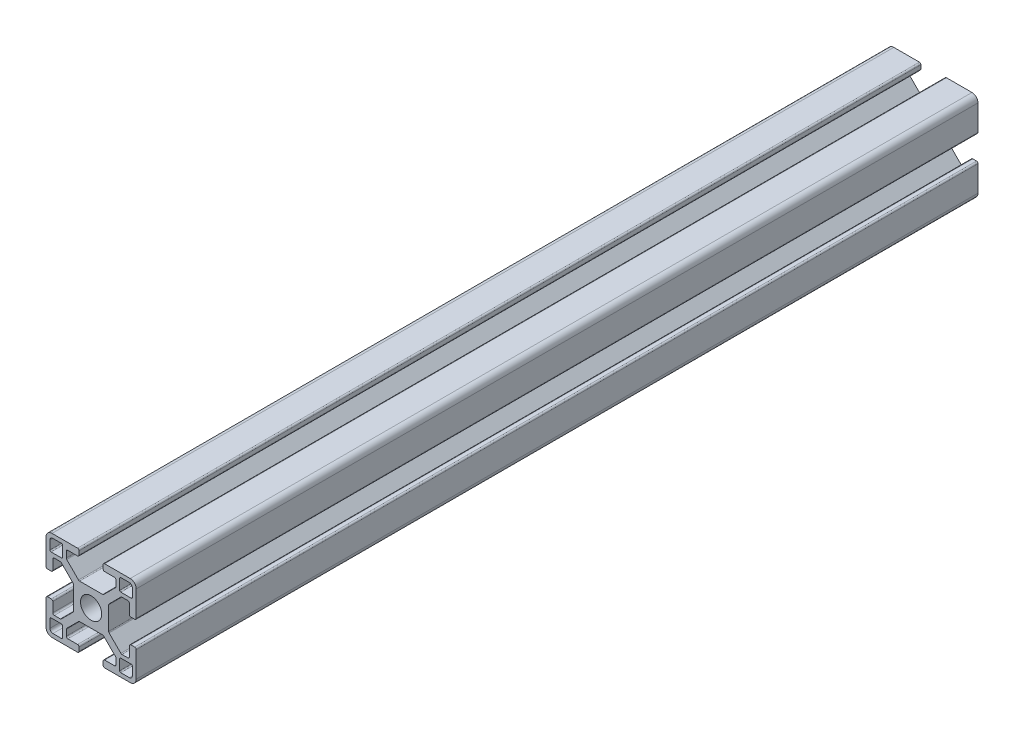
from build123d import *

# Parameters (mm, degrees)
SKETCH1_R           = 3.52998588
BOSS_EXTRUDE1_DEPTH = 140
SKETCH2_R           = 2.5
CUT_EXTRUDE1_DEPTH  = 27


with BuildPart() as part:
    # Sketch1 → Boss-Extrude1 (new, symmetric)
    with BuildSketch(Plane.XY):
        with BuildLine():
            Line((14.49994, -4), (13.24247465, -4))
            ThreePointArc((13.24247465, -4), (12.88892126, -4.146446609), (12.74247465, -4.5))
            Line((12.74247465, -4.5), (12.74247465, -7.732519321))
            ThreePointArc((12.74247465, -7.732519321), (12.602449697, -8.097296796), (12.242781236, -8.249967))
            Line((12.242781236, -8.249967), (10.260188032, -8.249967))
            ThreePointArc((10.260188032, -8.249967), (10.068847082, -8.211906919), (9.906636056, -8.103520976))
            Line((9.906636056, -8.103520976), (5.981117769, -4.178002689))
            ThreePointArc((5.981117769, -4.178002689), (5.872731827, -4.015791664), (5.834671745, -3.824450713))
            Line((5.834671745, -3.824450713), (5.834671745, -1.01249595))
            Line((5.834671745, -1.01249595), (5.834671745, 0.88749645))
            Line((5.834671745, 0.88749645), (5.834671745, 3.824450713))
            ThreePointArc((5.834671745, 3.824450713), (5.872731827, 4.015791664), (5.981117769, 4.178002689))
            Line((5.981117769, 4.178002689), (9.906636056, 8.103520976))
            ThreePointArc((9.906636056, 8.103520976), (10.068847082, 8.211906919), (10.260188032, 8.249967))
            Line((10.260188032, 8.249967), (12.242781236, 8.249967))
            ThreePointArc((12.242781236, 8.249967), (12.602449697, 8.097296796), (12.74247465, 7.732519321))
            Line((12.74247465, 7.732519321), (12.74247465, 4.5))
            ThreePointArc((12.74247465, 4.5), (12.88892126, 4.146446609), (13.24247465, 4))
            Line((13.24247465, 4), (14.49994, 4))
            ThreePointArc((14.49994, 4), (14.853493391, 4.146446609), (14.99994, 4.5))
            Line((14.99994, 4.5), (14.99994, 12.999948))
            ThreePointArc((14.99994, 12.999948), (14.414155906, 14.414155906), (12.999948, 14.99994))
            Line((12.999948, 14.99994), (4.5, 14.99994))
            ThreePointArc((4.5, 14.99994), (4.146446609, 14.853493391), (4, 14.49994))
            Line((4, 14.49994), (4, 13.24247465))
            ThreePointArc((4, 13.24247465), (4.146446609, 12.88892126), (4.5, 12.74247465))
            Line((4.5, 12.74247465), (7.732519321, 12.74247465))
            ThreePointArc((7.732519321, 12.74247465), (8.097296796, 12.602449697), (8.249967, 12.242781236))
            Line((8.249967, 12.242781236), (8.249967, 10.260188032))
            ThreePointArc((8.249967, 10.260188032), (8.211906919, 10.068847082), (8.103520976, 9.906636056))
            Line((8.103520976, 9.906636056), (4.178002689, 5.981117769))
            ThreePointArc((4.178002689, 5.981117769), (4.015791664, 5.872731827), (3.824450713, 5.834671745))
            Line((3.824450713, 5.834671745), (0.9499962, 5.834671745))
            Line((0.9499962, 5.834671745), (-0.9499962, 5.834671745))
            Line((-0.9499962, 5.834671745), (-3.824450713, 5.834671745))
            ThreePointArc((-3.824450713, 5.834671745), (-4.015791664, 5.872731827), (-4.178002689, 5.981117769))
            Line((-4.178002689, 5.981117769), (-8.103520976, 9.906636056))
            ThreePointArc((-8.103520976, 9.906636056), (-8.211906919, 10.068847082), (-8.249967, 10.260188032))
            Line((-8.249967, 10.260188032), (-8.249967, 12.242781236))
            ThreePointArc((-8.249967, 12.242781236), (-8.097296796, 12.602449697), (-7.732519321, 12.74247465))
            Line((-7.732519321, 12.74247465), (-4.5, 12.74247465))
            ThreePointArc((-4.5, 12.74247465), (-4.146446609, 12.88892126), (-4, 13.24247465))
            Line((-4, 13.24247465), (-4, 14.49994))
            ThreePointArc((-4, 14.49994), (-4.146446609, 14.853493391), (-4.5, 14.99994))
            Line((-4.5, 14.99994), (-12.999948, 14.99994))
            ThreePointArc((-12.999948, 14.99994), (-14.414155906, 14.414155906), (-14.99994, 12.999948))
            Line((-14.99994, 12.999948), (-14.99994, 4.5))
            ThreePointArc((-14.99994, 4.5), (-14.853493391, 4.146446609), (-14.49994, 4))
            Line((-14.49994, 4), (-13.24247465, 4))
            ThreePointArc((-13.24247465, 4), (-12.88892126, 4.146446609), (-12.74247465, 4.5))
            Line((-12.74247465, 4.5), (-12.74247465, 7.732519321))
            ThreePointArc((-12.74247465, 7.732519321), (-12.602449697, 8.097296796), (-12.242781236, 8.249967))
            Line((-12.242781236, 8.249967), (-10.260188032, 8.249967))
            ThreePointArc((-10.260188032, 8.249967), (-10.068847082, 8.211906919), (-9.906636056, 8.103520976))
            Line((-9.906636056, 8.103520976), (-5.981117769, 4.178002689))
            ThreePointArc((-5.981117769, 4.178002689), (-5.872731827, 4.015791664), (-5.834671745, 3.824450713))
            Line((-5.834671745, 3.824450713), (-5.834671745, 0.88749645))
            Line((-5.834671745, 0.88749645), (-5.834671745, -1.01249595))
            Line((-5.834671745, -1.01249595), (-5.834671745, -3.824450713))
            ThreePointArc((-5.834671745, -3.824450713), (-5.872731827, -4.015791664), (-5.981117769, -4.178002689))
            Line((-5.981117769, -4.178002689), (-9.906636056, -8.103520976))
            ThreePointArc((-9.906636056, -8.103520976), (-10.068847082, -8.211906919), (-10.260188032, -8.249967))
            Line((-10.260188032, -8.249967), (-12.242781236, -8.249967))
            ThreePointArc((-12.242781236, -8.249967), (-12.602449697, -8.097296796), (-12.74247465, -7.732519321))
            Line((-12.74247465, -7.732519321), (-12.74247465, -4.5))
            ThreePointArc((-12.74247465, -4.5), (-12.88892126, -4.146446609), (-13.24247465, -4))
            Line((-13.24247465, -4), (-14.49994, -4))
            ThreePointArc((-14.49994, -4), (-14.853493391, -4.146446609), (-14.99994, -4.5))
            Line((-14.99994, -4.5), (-14.99994, -12.999948))
            ThreePointArc((-14.99994, -12.999948), (-14.414155906, -14.414155906), (-12.999948, -14.99994))
            Line((-12.999948, -14.99994), (-4.5, -14.99994))
            ThreePointArc((-4.5, -14.99994), (-4.146446609, -14.853493391), (-4, -14.49994))
            Line((-4, -14.49994), (-4, -13.24247465))
            ThreePointArc((-4, -13.24247465), (-4.146446609, -12.88892126), (-4.5, -12.74247465))
            Line((-4.5, -12.74247465), (-7.732519321, -12.74247465))
            ThreePointArc((-7.732519321, -12.74247465), (-8.097296796, -12.602449697), (-8.249967, -12.242781236))
            Line((-8.249967, -12.242781236), (-8.249967, -10.260188032))
            ThreePointArc((-8.249967, -10.260188032), (-8.211906919, -10.068847082), (-8.103520976, -9.906636056))
            Line((-8.103520976, -9.906636056), (-4.178002689, -5.981117769))
            ThreePointArc((-4.178002689, -5.981117769), (-4.015791664, -5.872731827), (-3.824450713, -5.834671745))
            Line((-3.824450713, -5.834671745), (-0.9499962, -5.834671745))
            Line((-0.9499962, -5.834671745), (0.9499962, -5.834671745))
            Line((0.9499962, -5.834671745), (3.824450713, -5.834671745))
            ThreePointArc((3.824450713, -5.834671745), (4.015791664, -5.872731827), (4.178002689, -5.981117769))
            Line((4.178002689, -5.981117769), (8.103520976, -9.906636056))
            ThreePointArc((8.103520976, -9.906636056), (8.211906919, -10.068847082), (8.249967, -10.260188032))
            Line((8.249967, -10.260188032), (8.249967, -12.242781236))
            ThreePointArc((8.249967, -12.242781236), (8.097296796, -12.602449697), (7.732519321, -12.74247465))
            Line((7.732519321, -12.74247465), (4.5, -12.74247465))
            ThreePointArc((4.5, -12.74247465), (4.146446609, -12.88892126), (4, -13.24247465))
            Line((4, -13.24247465), (4, -14.49994))
            ThreePointArc((4, -14.49994), (4.146446609, -14.853493391), (4.5, -14.99994))
            Line((4.5, -14.99994), (12.999948, -14.99994))
            ThreePointArc((12.999948, -14.99994), (14.414155906, -14.414155906), (14.99994, -12.999948))
            Line((14.99994, -12.999948), (14.99994, -4.5))
            ThreePointArc((14.99994, -4.5), (14.853493391, -4.146446609), (14.49994, -4))
        make_face()
        Circle(SKETCH1_R, mode=Mode.SUBTRACT)
        with BuildLine():
            Line((-12.6999492, -13.6999452), (-9.880960476, -13.6999452))
            ThreePointArc((-9.880960476, -13.6999452), (-9.61155387, -13.58835333), (-9.499962, -13.318946724))
            Line((-9.499962, -13.318946724), (-9.499962, -9.87996048))
            ThreePointArc((-9.499962, -9.87996048), (-9.611260978, -9.611260978), (-9.87996048, -9.499962))
            Line((-9.87996048, -9.499962), (-13.318946724, -9.499962))
            ThreePointArc((-13.318946724, -9.499962), (-13.58835333, -9.61155387), (-13.6999452, -9.880960476))
            Line((-13.6999452, -9.880960476), (-13.6999452, -12.6999492))
            ThreePointArc((-13.6999452, -12.6999492), (-13.407053153, -13.407053153), (-12.6999492, -13.6999452))
        make_face(mode=Mode.SUBTRACT)
        with BuildLine():
            Line((13.6999452, -12.6999492), (13.6999452, -9.880960476))
            ThreePointArc((13.6999452, -9.880960476), (13.58835333, -9.61155387), (13.318946724, -9.499962))
            Line((13.318946724, -9.499962), (9.87996048, -9.499962))
            ThreePointArc((9.87996048, -9.499962), (9.611260978, -9.611260978), (9.499962, -9.87996048))
            Line((9.499962, -9.87996048), (9.499962, -13.318946724))
            ThreePointArc((9.499962, -13.318946724), (9.61155387, -13.58835333), (9.880960476, -13.6999452))
            Line((9.880960476, -13.6999452), (12.6999492, -13.6999452))
            ThreePointArc((12.6999492, -13.6999452), (13.407053153, -13.407053153), (13.6999452, -12.6999492))
        make_face(mode=Mode.SUBTRACT)
        with BuildLine():
            Line((9.87996048, 9.499962), (13.318946724, 9.499962))
            ThreePointArc((13.318946724, 9.499962), (13.58835333, 9.61155387), (13.6999452, 9.880960476))
            Line((13.6999452, 9.880960476), (13.6999452, 12.6999492))
            ThreePointArc((13.6999452, 12.6999492), (13.407053153, 13.407053153), (12.6999492, 13.6999452))
            Line((12.6999492, 13.6999452), (9.880960476, 13.6999452))
            ThreePointArc((9.880960476, 13.6999452), (9.61155387, 13.58835333), (9.499962, 13.318946724))
            Line((9.499962, 13.318946724), (9.499962, 9.87996048))
            ThreePointArc((9.499962, 9.87996048), (9.611260978, 9.611260978), (9.87996048, 9.499962))
        make_face(mode=Mode.SUBTRACT)
        with BuildLine():
            Line((-13.6999452, 12.6999492), (-13.6999452, 9.880960476))
            ThreePointArc((-13.6999452, 9.880960476), (-13.58835333, 9.61155387), (-13.318946724, 9.499962))
            Line((-13.318946724, 9.499962), (-9.87996048, 9.499962))
            ThreePointArc((-9.87996048, 9.499962), (-9.611260978, 9.611260978), (-9.499962, 9.87996048))
            Line((-9.499962, 9.87996048), (-9.499962, 13.318946724))
            ThreePointArc((-9.499962, 13.318946724), (-9.61155387, 13.58835333), (-9.880960476, 13.6999452))
            Line((-9.880960476, 13.6999452), (-12.6999492, 13.6999452))
            ThreePointArc((-12.6999492, 13.6999452), (-13.407053153, 13.407053153), (-13.6999452, 12.6999492))
        make_face(mode=Mode.SUBTRACT)
    extrude(amount=BOSS_EXTRUDE1_DEPTH, both=True)

    # Sketch2 → Cut-Extrude1 (cut)
    with BuildSketch(Plane.ZY.offset(14.99994)):
        with Locations((-135, 0)):
            Circle(SKETCH2_R)
        with Locations((-100, 0)):
            Circle(SKETCH2_R)
    extrude(amount=-CUT_EXTRUDE1_DEPTH, mode=Mode.SUBTRACT)


solid = part.part
